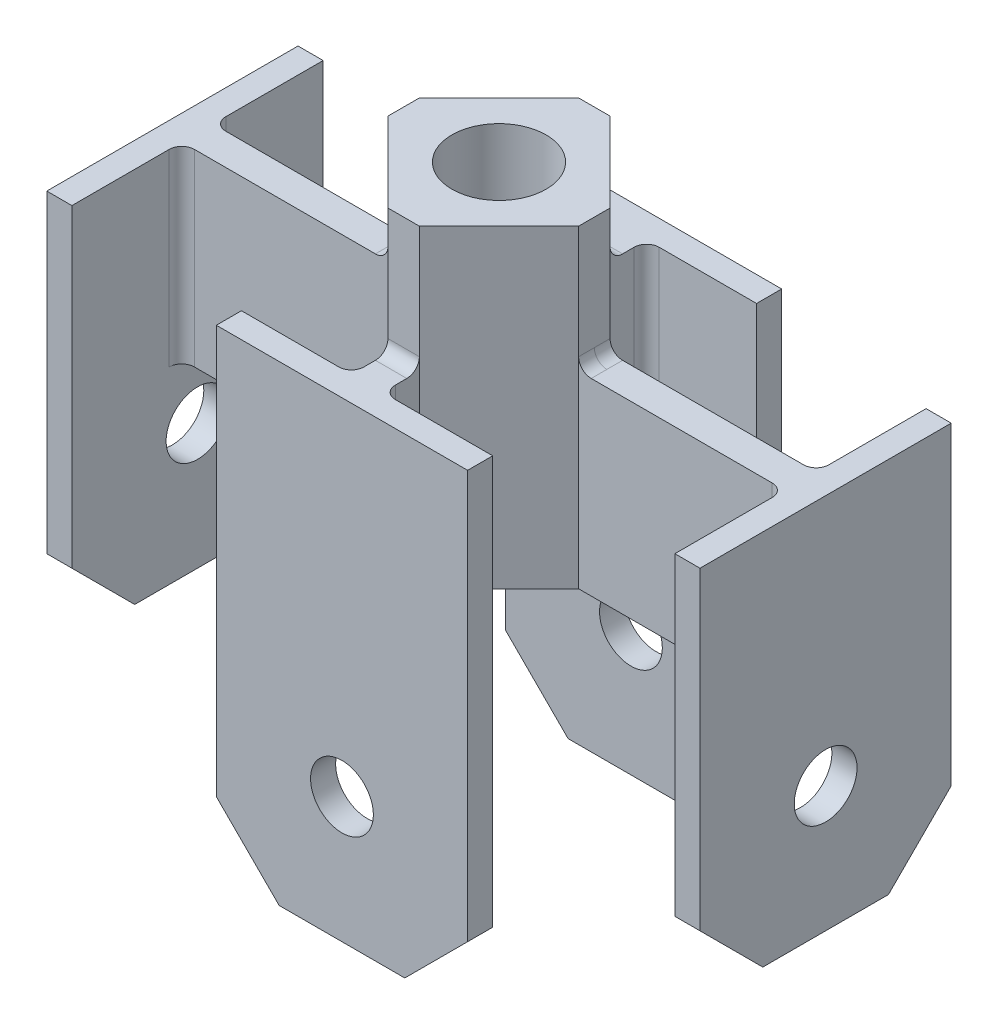
from build123d import *

# Parameters (mm, degrees)
BOSS_EXTRUDE2_START  = -38.1
BOSS_EXTRUDE2_DEPTH  = 63.5
SKETCH2_W            = 41.6814
SKETCH2_H            = 3.175
BOSS_EXTRUDE3_DEPTH  = 38.1
SKETCH3_W            = 5.08
SKETCH3_H            = 25.4
BOSS_EXTRUDE4_DEPTH  = 76.2
SKETCH4_W            = 3.175
SKETCH4_H            = 7.398582519
BOSS_EXTRUDE5_DEPTH  = 38.1
SKETCH5_W            = 25.4
SKETCH5_H            = 5.075789281
BOSS_EXTRUDE6_DEPTH  = 95.25
FILLET1_R            = 2.54
CUT_EXTRUDE1_DEPTH   = 5.075789281
CUT_EXTRUDE2_DEPTH   = 5.08
FILLET1_OF_MIRROR5_R = 2.54
FILLET3_R            = 2.54
SKETCH9_R            = 9.525
CUT_EXTRUDE3_DEPTH   = 50.8
SKETCH11_R           = 6.35
CUT_EXTRUDE4_DEPTH   = 166.904133083
SKETCH12_R           = 6.35
CUT_EXTRUDE5_DEPTH   = 175.78091679


with BuildPart() as part:
    # Sketch1 → Boss-Extrude2 (new body)
    with BuildSketch(Plane(origin=(0, 0, 0), x_dir=(1, 0, 0), z_dir=(0, 1, 0)).offset(BOSS_EXTRUDE2_START)):
        Polygon((46.7614, 3.175), (46.7614, 0), (66.0370282, 0), (66.0370282, 19.2756282), (62.8620282, 19.2756282), align=None)
    boss_extrude2 = extrude(amount=BOSS_EXTRUDE2_DEPTH)

    # Sketch2 → Boss-Extrude3 (add)
    with BuildSketch(Plane(origin=(0, 0, 0), x_dir=(1, 0, 0), z_dir=(0, 1, 0))):
        with Locations((25.9207, 1.5875)):
            Rectangle(SKETCH2_W, SKETCH2_H)
    boss_extrude3 = extrude(amount=-BOSS_EXTRUDE3_DEPTH)

    # Sketch3 → Boss-Extrude4 (add)
    with BuildSketch(Plane(origin=(0, 0, 0), x_dir=(1, 0, 0), z_dir=(0, 1, 0))):
        with Locations((2.54, 12.7)):
            Rectangle(SKETCH3_W, SKETCH3_H)
    boss_extrude4 = extrude(amount=-BOSS_EXTRUDE4_DEPTH)

    # Sketch4 → Boss-Extrude5 (add)
    with BuildSketch(Plane(origin=(0, 0, 0), x_dir=(1, 0, 0), z_dir=(0, 1, 0))):
        with Locations((64.4495282, 22.97491946)):
            Rectangle(SKETCH4_W, SKETCH4_H)
    boss_extrude5 = extrude(amount=-BOSS_EXTRUDE5_DEPTH)

    # Sketch5 → Boss-Extrude6 (add)
    with BuildSketch(Plane(origin=(0, 0, 0), x_dir=(1, 0, 0), z_dir=(0, 1, 0))):
        with Locations((53.3370282, 29.21210536)):
            Rectangle(SKETCH5_W, SKETCH5_H)
    boss_extrude6 = extrude(amount=-BOSS_EXTRUDE6_DEPTH)

    # Fillet1
    fillet1_edges = [part.edges().sort_by_distance(p)[0] for p in [
        (5.08, -19.05, -3.175),
        (46.7614, 0, -1.5875),
        (62.8620282, -19.05, -26.674210719),
    ]]
    fillet(fillet1_edges, radius=FILLET1_R)

    # Sketch7 → Cut-Extrude1 (cut)
    with BuildSketch(Plane(origin=(0, 0, -31.75), x_dir=(-1, 0, 0), z_dir=(0, 0, -1))):
        Polygon((-40.6370282, -82.55), (-53.3370282, -95.25), (-40.6370282, -95.25), align=None)
    cut_extrude1 = extrude(amount=-CUT_EXTRUDE1_DEPTH, mode=Mode.SUBTRACT)

    # Sketch8 → Cut-Extrude2 (cut)
    with BuildSketch(Plane.ZY):
        Polygon((-25.4, -76.2), (-25.4, -63.5), (-12.7, -76.2), align=None)
    cut_extrude2 = extrude(amount=-CUT_EXTRUDE2_DEPTH, mode=Mode.SUBTRACT)

    # Mirror5: Boss-Extrude2, Boss-Extrude3, Boss-Extrude4, Boss-Extrude5, Boss-Extrude6, Cut-Extrude1, Cut-Extrude2 across plane
    add(boss_extrude2.mirror(Plane(origin=(0, -38.1, 0), x_dir=(1, 0, 0), z_dir=(0, 0, 1))))
    add(boss_extrude3.mirror(Plane(origin=(0, -38.1, 0), x_dir=(1, 0, 0), z_dir=(0, 0, 1))))
    add(boss_extrude4.mirror(Plane(origin=(0, -38.1, 0), x_dir=(1, 0, 0), z_dir=(0, 0, 1))))
    add(boss_extrude5.mirror(Plane(origin=(0, -38.1, 0), x_dir=(1, 0, 0), z_dir=(0, 0, 1))))
    add(boss_extrude6.mirror(Plane(origin=(0, -38.1, 0), x_dir=(1, 0, 0), z_dir=(0, 0, 1))))
    add(cut_extrude1.mirror(Plane(origin=(0, -38.1, 0), x_dir=(1, 0, 0), z_dir=(0, 0, 1))), mode=Mode.SUBTRACT)
    add(cut_extrude2.mirror(Plane(origin=(0, -38.1, 0), x_dir=(1, 0, 0), z_dir=(0, 0, 1))), mode=Mode.SUBTRACT)

    # Fillet1 of Mirror5
    fillet1_of_mirror5_edges = [part.edges().sort_by_distance(p)[0] for p in [
        (5.08, -19.05, 3.175),
        (46.7614, 0, 1.5875),
        (62.8620282, -19.05, 26.674210719),
    ]]
    fillet(fillet1_of_mirror5_edges, radius=FILLET1_OF_MIRROR5_R)

    # Mirror6: part across plane


with BuildPart() as part_1:
    add(part.part)
    add(part.part.mirror(Plane(origin=(66.0370282, -38.1, 0), x_dir=(0, 0, 1), z_dir=(1, 0, 0))))

    # Fillet3
    fillet3_edges = [part_1.edges().sort_by_distance(p)[0] for p in [
        (66.0370282, 0, 19.2756282),
        (66.0370282, 0, -19.2756282),
    ]]
    fillet(fillet3_edges, radius=FILLET3_R)

    # Sketch9 → Cut-Extrude3 (cut)
    with BuildSketch(Plane(origin=(0, 25.4, 0), x_dir=(1, 0, 0), z_dir=(0, 1, 0))):
        with Locations(Location((66.0370282, 0, 0), (0, 0, 270))):
            Circle(SKETCH9_R)
    extrude(amount=-CUT_EXTRUDE3_DEPTH, mode=Mode.SUBTRACT)

    # Sketch11 → Cut-Extrude4 (cut, through all)
    with BuildSketch(Plane(origin=(132.0740564, 0, 0), x_dir=(0, 0, -1), z_dir=(1, 0, 0))):
        with Locations((0, -50.8)):
            Circle(SKETCH11_R)
    extrude(amount=-CUT_EXTRUDE4_DEPTH, mode=Mode.SUBTRACT)

    # Sketch12 → Cut-Extrude5 (cut, through all)
    with BuildSketch(Plane.XY.offset(31.75)):
        with Locations((66.0370282, -69.85)):
            Circle(SKETCH12_R)
    extrude(amount=-CUT_EXTRUDE5_DEPTH, mode=Mode.SUBTRACT)


solid = part_1.part
